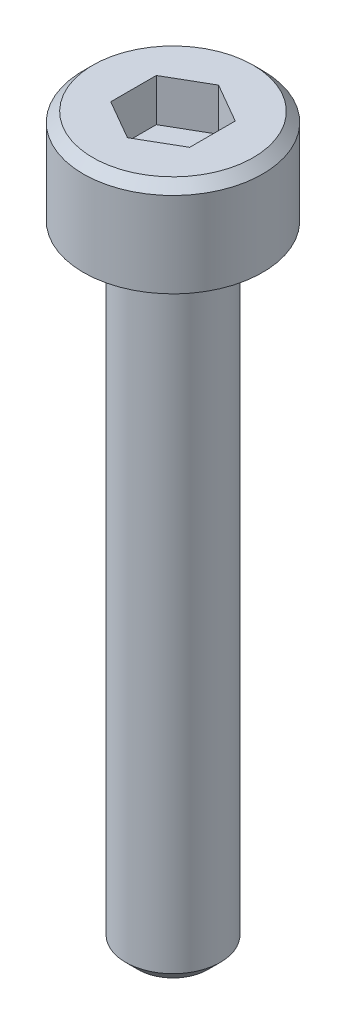
from build123d import *

# Parameters (mm, degrees)
CUT_EXTRUDE1_DEPTH = 1.35


with BuildPart() as part:
    # Sketch1 → Revolve1 (revolve)
    with BuildSketch(Plane.XY, mode=Mode.PRIVATE) as revolve1_sk:
        Polygon((0, -20), (1.1, -20), (1.5, -19.6), (1.5, 0), (2.84, 0), (2.84, 2.7), (2.54, 3), (0, 3), align=None)
    revolve(revolve1_sk.sketch.rotate(Axis((0, -10, 0), (0, 1, 0)), 90), axis=Axis((0, -10, 0), (0, 1, 0)))

    # Sketch2 → Cut-Extrude1 (cut)
    with BuildSketch(Plane(origin=(0, 3, 0), x_dir=(1, 0, 0), z_dir=(0, 1, 0))):
        Polygon((1.25, -0.721687836), (0, -1.443375673), (-1.25, -0.721687836), (-1.25, 0.721687836), (0, 1.443375673), (1.25, 0.721687836), align=None)
    extrude(amount=-CUT_EXTRUDE1_DEPTH, mode=Mode.SUBTRACT)


solid = part.part
